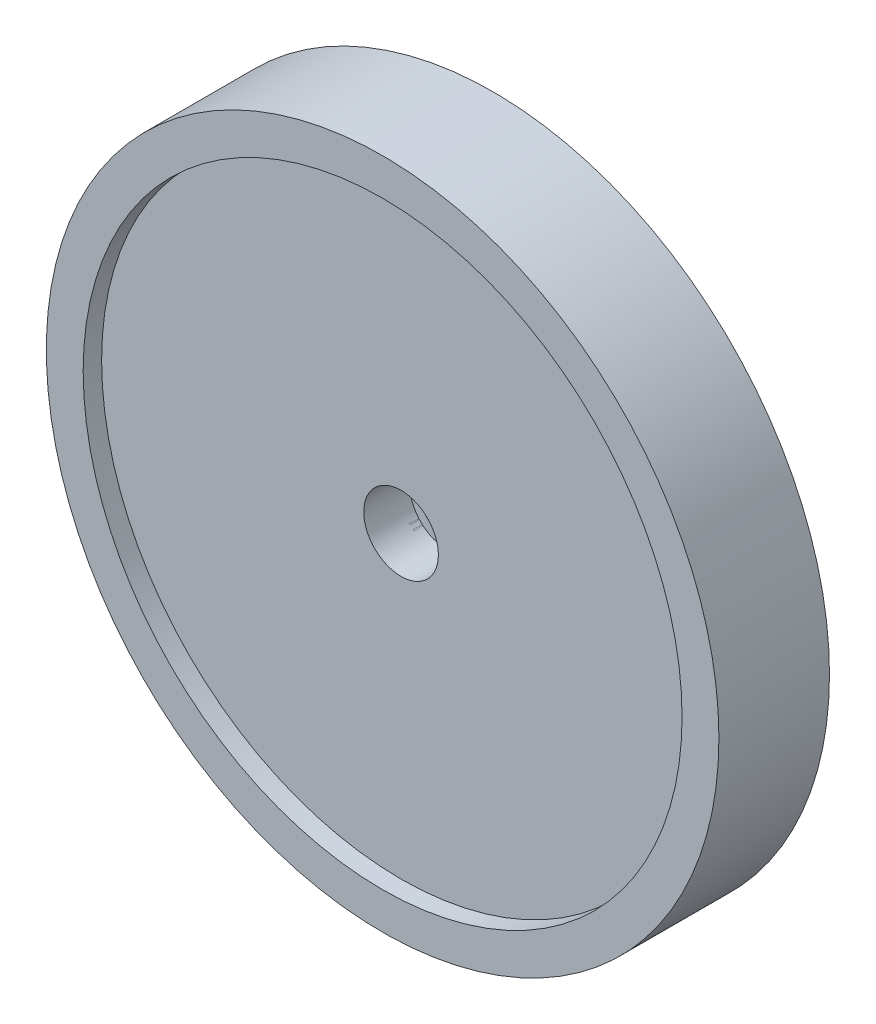
from build123d import *

# Parameters (mm, degrees)
CROQUIS1_R                 = 36.5
SALIENTE_EXTRUIR1_DEPTH    = 6
CROQUIS3_R                 = 32.5
CORTAR_EXTRUIR2_DEPTH      = 2
CORTAR_EXTRUIR3_START      = -5
CROQUIS4_R                 = 32.5
CORTAR_EXTRUIR3_DEPTH      = 5
SALIENTE_EXTRUIR2_DEPTH    = 0.5
SALIENTE_EXTRUIR3_DEPTH    = 0.5
SALIENTE_EXTRUIR7_DEPTH    = 0.5
SALIENTE_EXTRUIR8_DEPTH    = 0.5
CORTAR_EXTRUIR4_DEPTH      = 68
CORTAR_EXTRUIR4_DEPTH_BACK = 62
CROQUIS2_R                 = 4.05
CROQUIS7_R                 = 4.05
CROQUIS7_R_2               = 3.05
SALIENTE_EXTRUIR10_DEPTH   = 8.345621


with BuildPart() as part:
    # Croquis1 → Saliente-Extruir1 (new, symmetric)
    with BuildSketch(Plane.XY):
        Circle(CROQUIS1_R)
    extrude(amount=SALIENTE_EXTRUIR1_DEPTH, both=True)

    # Croquis3 → Cortar-Extruir2 (cut)
    with BuildSketch(Plane.XY.offset(6)):
        Circle(CROQUIS3_R)
    extrude(amount=-CORTAR_EXTRUIR2_DEPTH, mode=Mode.SUBTRACT)

    # Croquis4 → Cortar-Extruir3 (cut)
    with BuildSketch(Plane(origin=(0, 0, -6), x_dir=(-1, 0, 0), z_dir=(0, 0, -1)).offset(CORTAR_EXTRUIR3_START)):
        with Locations(Location((0, 0, 0), (0, 0, 180))):
            Circle(CROQUIS4_R)
    extrude(amount=CORTAR_EXTRUIR3_DEPTH, mode=Mode.SUBTRACT)

    # Croquis5 → Saliente-Extruir2 (add, symmetric)
    with BuildSketch(Plane(origin=(0, 0, 0), x_dir=(0, 0, -1), z_dir=(1, 0, 0))):
        Polygon((12.654998478, 0), (0, -15.487124121), (0, 15.487124121), align=None)
    extrude(amount=SALIENTE_EXTRUIR2_DEPTH, both=True)

    # Croquis6 → Saliente-Extruir3 (add, symmetric)
    with BuildSketch(Plane(origin=(0, 0, 0), x_dir=(1, 0, 0), z_dir=(0, 1, 0))):
        Polygon((0, 12.654998478), (-15.487124121, 0), (15.487124121, 0), align=None)
    extrude(amount=SALIENTE_EXTRUIR3_DEPTH, both=True)


with BuildPart() as body_2:
    # Croquis10 → Saliente-Extruir7 (new, symmetric)
    with BuildSketch(Plane(origin=(0, 0, 4), x_dir=(0, 0, 1), z_dir=(-0.7071067811865488, 0.7071067811865464, 0))):
        Polygon((-4, -15.657340875), (-16.612062838, -0.135231772), (-4, 15.38687733), align=None)
    extrude(amount=SALIENTE_EXTRUIR7_DEPTH, both=True)


with BuildPart() as body_3:
    # Croquis14 → Saliente-Extruir8 (new, symmetric)
    with BuildSketch(Plane(origin=(0, 0, 4), x_dir=(-0.7071067811865486, 0.7071067811865465, 0), z_dir=(-0.7071067811865465, -0.7071067811865486, 0))):
        Polygon((-15.522109102, 4), (0, 16.612062838), (15.522109102, 4), align=None)
    extrude(amount=SALIENTE_EXTRUIR8_DEPTH, both=True)


with BuildPart() as cortar_extruir4_tool:
    # Croquis2 → Cortar-Extruir4 (new, two sides: drawn at the far end of the back side and taken through both)
    with BuildSketch(Plane(origin=(0, 0, -6), x_dir=(-1, 0, 0), z_dir=(0, 0, -1)).offset(-CORTAR_EXTRUIR4_DEPTH_BACK)):
        with Locations(Location((0, 0, 0), (0, 0, 180))):
            Circle(CROQUIS2_R)
    extrude(amount=CORTAR_EXTRUIR4_DEPTH + CORTAR_EXTRUIR4_DEPTH_BACK)


with BuildPart() as part_1:
    add(part.part)

    # Cortar-Extruir4: cut by cortar_extruir4_tool
    add(cortar_extruir4_tool.part, mode=Mode.SUBTRACT)


with BuildPart() as body_2_1:
    add(body_2.part)

    # Cortar-Extruir4: cut by cortar_extruir4_tool
    add(cortar_extruir4_tool.part, mode=Mode.SUBTRACT)


with BuildPart() as body_3_1:
    add(body_3.part)

    # Cortar-Extruir4: cut by cortar_extruir4_tool
    add(cortar_extruir4_tool.part, mode=Mode.SUBTRACT)


with BuildPart() as body_4:
    # Croquis7 → Saliente-Extruir10 (new body)
    with BuildSketch(Plane(origin=(0, 0, -1), x_dir=(-1, 0, 0), z_dir=(0, 0, -1))):
        Circle(CROQUIS7_R)
        Circle(CROQUIS7_R_2, mode=Mode.SUBTRACT)
    extrude(amount=SALIENTE_EXTRUIR10_DEPTH)


solid = Compound([part_1.part, body_2_1.part, body_3_1.part, body_4.part])
